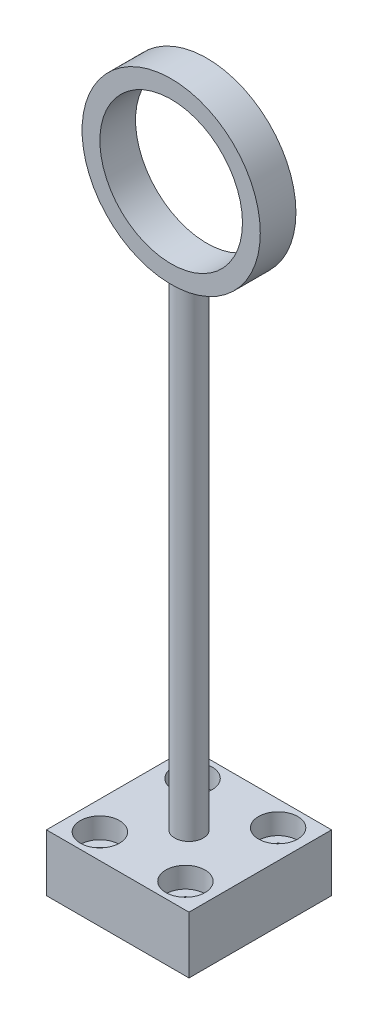
from build123d import *

# Parameters (mm, degrees)
SKETCH_1_R                     = 12.5
SKETCH_1_R_2                   = 10
EXTRUDE_1_DEPTH                = 5
EXTRUDE_2_REACH                = 95.475
EXTRUDE_2_END_RADIUS           = 12.5
SKETCH_2_R                     = 2
SKETCH_3_W                     = 20
SKETCH_3_H                     = 20
EXTRUDE_3_DEPTH                = 8
HOLE_WIZARD_M2_5_1_D           = 2.9
HOLE_WIZARD_M2_5_1_CBORE_D     = 5.5
HOLE_WIZARD_M2_5_1_CBORE_DEPTH = 2.9


with BuildPart() as part:
    # 草图1 → 凸台-拉伸1 (new body)
    with BuildSketch(Plane.XY):
        Circle(SKETCH_1_R)
        Circle(SKETCH_1_R_2, mode=Mode.SUBTRACT)
    extrude(amount=EXTRUDE_1_DEPTH)

    # 凸台-拉伸2: up to this cylinder (the profile starts outside it)
    extrude_2_end = Plane(origin=(0, 0, 2.5), z_dir=(0, 0, -1)) * Cylinder(EXTRUDE_2_END_RADIUS, 216.95, mode=Mode.PRIVATE)
    # 草图2 → 凸台-拉伸2 (add, up to the surface)
    with BuildSketch(Plane(origin=(0, -80, 0), x_dir=(1, 0, 0), z_dir=(0, 1, 0)), mode=Mode.PRIVATE) as extrude_2_sk1:
        with Locations(Location((0, -2.5, 0), (0, 0, 90))):
            Circle(SKETCH_2_R)
    extrude_2_tool1 = extrude(extrude_2_sk1.sketch, amount=EXTRUDE_2_REACH, mode=Mode.PRIVATE) - extrude_2_end
    add(extrude_2_tool1.solids().sort_by_distance((0, -80, 2.5))[0])

    # 草图3 → 凸台-拉伸3 (add)
    with BuildSketch(Plane.XZ.offset(80)):
        with Locations((0, 2.5)):
            Rectangle(SKETCH_3_W, SKETCH_3_H)
    extrude(amount=EXTRUDE_3_DEPTH)

    # M2.5 六角凹头螺钉的柱形沉头孔1 (through all)
    with Locations(Plane(origin=(0, -80, 0), x_dir=(1, 0, 0), z_dir=(0, 1, 0))):
        with Locations((-6, 4), (6, 4), (6, -9), (-6, -9)):
            CounterBoreHole(HOLE_WIZARD_M2_5_1_D / 2, HOLE_WIZARD_M2_5_1_CBORE_D / 2, HOLE_WIZARD_M2_5_1_CBORE_DEPTH)


solid = part.part
